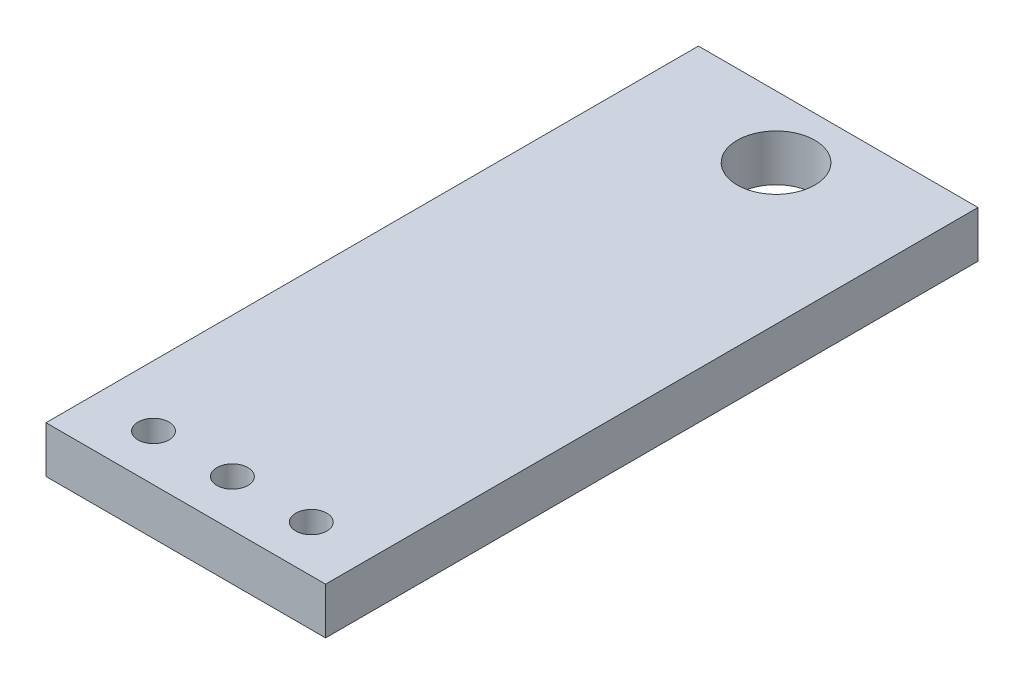
from build123d import *

# Parameters (mm, degrees)
CROQUIS1_W              = 9
CROQUIS1_H              = 21
CROQUIS1_R              = 1.25
CROQUIS1_R_2            = 0.5
SALIENTE_EXTRUIR1_DEPTH = 1.5


with BuildPart() as part:
    # Croquis1 → Saliente-Extruir1 (new body)
    with BuildSketch(Plane(origin=(0, 0, 0), x_dir=(1, 0, 0), z_dir=(0, 1, 0))):
        Rectangle(CROQUIS1_W, CROQUIS1_H)
        with Locations(Location((0, 8.5, 0), (0, 0, 270))):
            Circle(CROQUIS1_R, mode=Mode.SUBTRACT)
        with Locations(Location((-2.54, -9, 0), (0, 0, 270))):
            Circle(CROQUIS1_R_2, mode=Mode.SUBTRACT)
        with Locations(Location((0, -9, 0), (0, 0, 270))):
            Circle(CROQUIS1_R_2, mode=Mode.SUBTRACT)
        with Locations(Location((2.54, -9, 0), (0, 0, 270))):
            Circle(CROQUIS1_R_2, mode=Mode.SUBTRACT)
    extrude(amount=SALIENTE_EXTRUIR1_DEPTH)


solid = part.part
